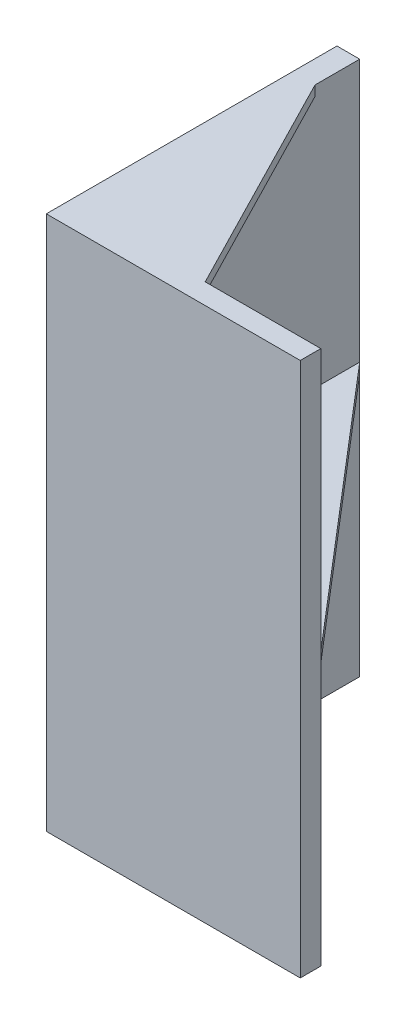
from build123d import *

# Parameters (mm, degrees)
BOSS_EXTRUDE2_DEPTH = 135.89
RIB18_REACH         = 308.18
SKETCH4_WALL_W      = 743.085279388
SKETCH4_WALL_H      = 5.08
RIB27_REACH         = 197.826
SKETCH6_WALL_W      = 574.331256006
SKETCH6_WALL_H      = 5.08


with BuildPart() as part:
    # Sketch1 → Boss-Extrude2 (new, symmetric)
    with BuildSketch(Plane(origin=(0, 0, 0), x_dir=(1, 0, 0), z_dir=(0, 1, 0))):
        Polygon((-11.562777715, 77.955501368), (0, 77.955501368), (0, -59.305859892), (117.492741296, -59.305859892), (117.492741296, -69.749659119), (-11.562777715, -69.749659119), (-11.562777715, -59.305859892), align=None)
    extrude(amount=BOSS_EXTRUDE2_DEPTH, both=True)

    # Sketch4 wall → Rib18 (add, up to next)
    with BuildSketch(Plane(origin=(29.373185324, 135.89, 2.036221127), x_dir=(0.456367573522, 0, 0.889791345113), z_dir=(0.889791345113, 0, -0.456367573522)), mode=Mode.PRIVATE) as rib18_sk1:
        with Locations((0, 2.54)):
            Rectangle(SKETCH4_WALL_W, SKETCH4_WALL_H)
    rib18_tool1 = extrude(rib18_sk1.sketch, amount=-RIB18_REACH, mode=Mode.PRIVATE) - part.part
    add(rib18_tool1.solids().sort_by_distance((29.373185324, 135.89, 2.036221127))[0])

    # Sketch6 wall → Rib27 (add, up to next)
    with BuildSketch(Plane(origin=(58.746370648, 0, -9.324820738), x_dir=(0.650281202153, 0, 0.759693594896), z_dir=(0.759693594896, 0, -0.650281202153)), mode=Mode.PRIVATE) as rib27_sk1:
        Rectangle(SKETCH6_WALL_W, SKETCH6_WALL_H)
    rib27_tool1 = extrude(rib27_sk1.sketch, amount=-RIB27_REACH, mode=Mode.PRIVATE) - part.part
    add(rib27_tool1.solids().sort_by_distance((58.746370648, 0, -9.324820738))[0])


solid = part.part
